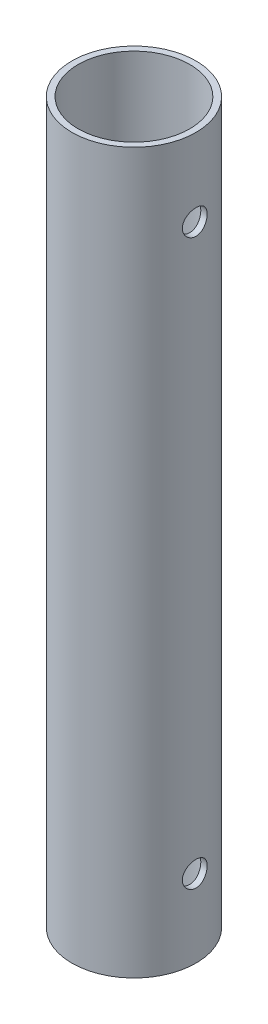
from build123d import *

# Parameters (mm, degrees)
SKETCH1_R           = 10
SKETCH1_R_2         = 9
BOSS_EXTRUDE1_DEPTH = 116
SKETCH3_R           = 2
CUT_EXTRUDE2_DEPTH  = 119.135515405


with BuildPart() as part:
    # Sketch1 → Boss-Extrude1 (new body)
    with BuildSketch(Plane(origin=(0, 0, 0), x_dir=(1, 0, 0), z_dir=(0, 1, 0))):
        with Locations(Location((0, 0, 0), (0, 0, 90))):
            Circle(SKETCH1_R)
        with Locations(Location((0, 0, 0), (0, 0, 90))):
            Circle(SKETCH1_R_2, mode=Mode.SUBTRACT)
    extrude(amount=BOSS_EXTRUDE1_DEPTH)

    # Sketch3 → Cut-Extrude2 (cut, through all)
    with BuildSketch(Plane(origin=(10, 0, 0), x_dir=(0, 0, -1), z_dir=(1, 0, 0))):
        with Locations((0, 103.5)):
            Circle(SKETCH3_R)
        with Locations((0, 12.5)):
            Circle(SKETCH3_R)
    extrude(amount=-CUT_EXTRUDE2_DEPTH, mode=Mode.SUBTRACT)


solid = part.part
